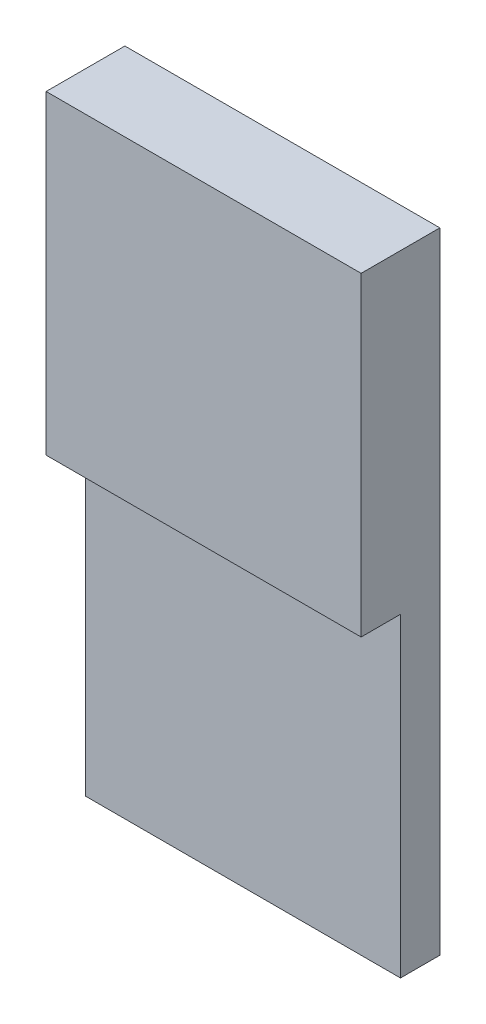
from build123d import *

# Parameters (mm, degrees)
SKETCH1_W           = 200
SKETCH1_H           = 200
BOSS_EXTRUDE1_DEPTH = 25
SKETCH2_W           = 200
SKETCH2_H           = 200
BOSS_EXTRUDE2_DEPTH = 50


with BuildPart() as part:
    # Sketch1 → Boss-Extrude1 (new body)
    with BuildSketch(Plane.XY):
        Rectangle(SKETCH1_W, SKETCH1_H)
    extrude(amount=BOSS_EXTRUDE1_DEPTH)

    # Sketch2 → Boss-Extrude2 (add)
    with BuildSketch(Plane(origin=(0, 0, 0), x_dir=(-1, 0, 0), z_dir=(0, 0, -1))):
        with Locations((0, 200)):
            Rectangle(SKETCH2_W, SKETCH2_H)
    extrude(amount=-BOSS_EXTRUDE2_DEPTH)


solid = part.part
